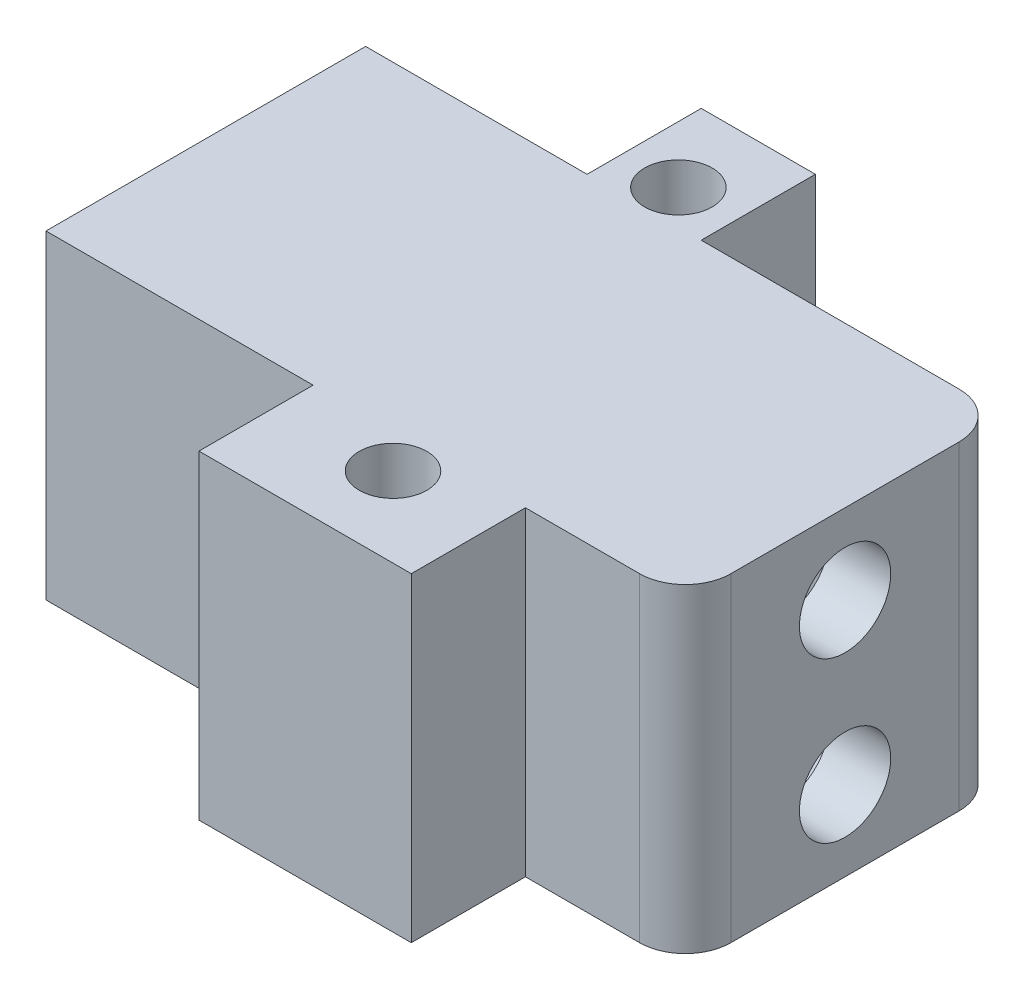
from build123d import *

# Parameters (mm, degrees)
SKETCH_1_W          = 28
SKETCH_1_H          = 14
EXTRUDE_1_DEPTH     = 14
SKETCH_2_W          = 10
SKETCH_2_H          = 12
CUT_EXTRUDE_1_DEPTH = 25.3
SKETCH_3_R          = 2
CUT_EXTRUDE_2_DEPTH = 25.5
FILLET_4_R          = 2
SKETCH_4_W          = 9.3
SKETCH_4_H          = 14
EXTRUDE_2_DEPTH     = 5
SKETCH_5_W          = 5
SKETCH_5_H          = 14
EXTRUDE_3_DEPTH     = 5
SKETCH_6_R          = 1.48
CUT_EXTRUDE_3_DEPTH = 20


with BuildPart() as part:
    # 草图1 → 凸台-拉伸1 (new body)
    with BuildSketch(Plane(origin=(0, 0, 0), x_dir=(1, 0, 0), z_dir=(0, 1, 0))):
        Rectangle(SKETCH_1_W, SKETCH_1_H)
    extrude(amount=EXTRUDE_1_DEPTH)

    # 草图2 → 切除-拉伸1 (cut)
    with BuildSketch(Plane.ZY.offset(14)):
        with Locations((0, 7)):
            Rectangle(SKETCH_2_W, SKETCH_2_H)
    extrude(amount=-CUT_EXTRUDE_1_DEPTH, mode=Mode.SUBTRACT)

    # 草图3 → 切除-拉伸2 (cut)
    with BuildSketch(Plane(origin=(14, 0, 0), x_dir=(0, 0, -1), z_dir=(1, 0, 0))):
        with Locations((0, 10.5)):
            Circle(SKETCH_3_R)
        with Locations((0, 3.5)):
            Circle(SKETCH_3_R)
    extrude(amount=-CUT_EXTRUDE_2_DEPTH, mode=Mode.SUBTRACT)

    # 圆角4
    fillet_4_edges = [part.edges().sort_by_distance(p)[0] for p in [
        (14, 7, 7),
        (14, 7, -7),
    ]]
    fillet(fillet_4_edges, radius=FILLET_4_R)

    # 草图4 → 凸台-拉伸2 (add)
    with BuildSketch(Plane.XY.offset(7)):
        with Locations((2.35, 7)):
            Rectangle(SKETCH_4_W, SKETCH_4_H)
    extrude(amount=EXTRUDE_2_DEPTH)

    # 草图5 → 凸台-拉伸3 (add)
    with BuildSketch(Plane(origin=(0, 0, -7), x_dir=(-1, 0, 0), z_dir=(0, 0, -1))):
        with Locations((1.8, 7)):
            Rectangle(SKETCH_5_W, SKETCH_5_H)
    extrude(amount=EXTRUDE_3_DEPTH)

    # 草图6 → 切除-拉伸3 (cut)
    with BuildSketch(Plane(origin=(0, 14, 0), x_dir=(1, 0, 0), z_dir=(0, 1, 0))):
        with Locations(Location((2.7, -8.5, 0), (0, 0, 270))):
            Circle(SKETCH_6_R)
        with Locations(Location((-1.8, 8.5, 0), (0, 0, 270))):
            Circle(SKETCH_6_R)
    extrude(amount=-CUT_EXTRUDE_3_DEPTH, mode=Mode.SUBTRACT)


solid = part.part
